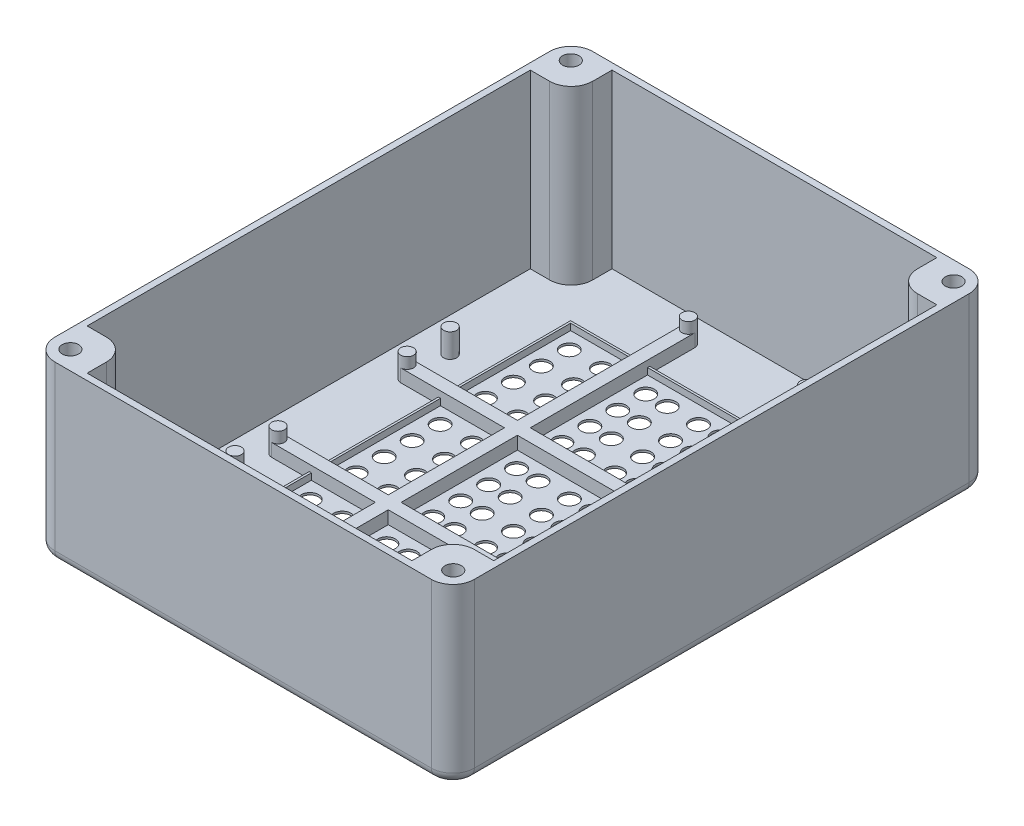
from build123d import *

# Parameters (mm, degrees)
SKETCH1_W              = 195
SKETCH1_H              = 250
SKETCH1_W_2            = 189
SKETCH1_H_2            = 244
BOSS_EXTRUDE1_DEPTH    = 80
SKETCH2_W              = 22
SKETCH2_H              = 22
BOSS_EXTRUDE2_DEPTH    = 80
SKETCH4_R              = 3
BOSS_EXTRUDE3_DEPTH    = 11.1
SKETCH4_R_2            = 4
BOSS_EXTRUDE3_2_DEPTH  = 11.1
BOSS_EXTRUDE3_3_DEPTH  = 11.1
BOSS_EXTRUDE3_4_DEPTH  = 11.1
BOSS_EXTRUDE3_5_DEPTH  = 11.1
BOSS_EXTRUDE3_6_DEPTH  = 11.1
BOSS_EXTRUDE3_7_DEPTH  = 11.1
BOSS_EXTRUDE3_8_DEPTH  = 11.1
BOSS_EXTRUDE3_9_DEPTH  = 11.1
BOSS_EXTRUDE3_10_DEPTH = 11.1
BOSS_EXTRUDE3_11_DEPTH = 11.1
BOSS_EXTRUDE3_12_DEPTH = 11.1
BOSS_EXTRUDE3_13_DEPTH = 11.1
SKETCH5_W              = 195
SKETCH5_H              = 250
BOSS_EXTRUDE4_DEPTH    = 1
FILLET1_R              = 10
FILLET2_R              = 10
FILLET3_R              = 5
SKETCH6_W              = 122.5
SKETCH6_H              = 177
SKETCH6_W_2            = 120.5
SKETCH6_H_2            = 175
BOSS_EXTRUDE5_DEPTH    = 3
SKETCH7_W              = 6
SKETCH7_H              = 219.117056947
SKETCH7_H_2            = 218.65559357
SKETCH7_W_2            = 157.5
SKETCH7_H_3            = 6
BOSS_EXTRUDE6_DEPTH    = 6
SKETCH8_W              = 122.5
SKETCH8_H              = 177
SKETCH8_W_2            = 120.5
SKETCH8_H_2            = 175
BOSS_EXTRUDE7_DEPTH    = 3
CUT_EXTRUDE1_START     = 80
CUT_EXTRUDE1_DEPTH     = 50
SKETCH10_R             = 4
CUT_EXTRUDE2_DEPTH     = 173.853868975
SKETCH11_R             = 4
SKETCH11_R_2           = 3.9375
CUT_EXTRUDE3_DEPTH     = 178.570408626


with BuildPart() as part:
    # Sketch1 → Boss-Extrude1 (new body)
    with BuildSketch(Plane(origin=(0, 0, 0), x_dir=(1, 0, 0), z_dir=(0, 1, 0))):
        Rectangle(SKETCH1_W, SKETCH1_H)
        Rectangle(SKETCH1_W_2, SKETCH1_H_2, mode=Mode.SUBTRACT)
    extrude(amount=BOSS_EXTRUDE1_DEPTH)

    # Sketch2 → Boss-Extrude2 (add)
    with BuildSketch(Plane.XZ):
        with Locations((86.5, -114)):
            Rectangle(SKETCH2_W, SKETCH2_H)
        with Locations((-86.5, -114)):
            Rectangle(SKETCH2_W, SKETCH2_H)
        with Locations((-86.5, 114)):
            Rectangle(SKETCH2_W, SKETCH2_H)
        with Locations((86.5, 114)):
            Rectangle(SKETCH2_W, SKETCH2_H)
    extrude(amount=-BOSS_EXTRUDE2_DEPTH)



with BuildPart() as body_2:
    # Sketch4 → Boss-Extrude3 (new body)
    with BuildSketch(Plane(origin=(0, 0, 0), x_dir=(1, 0, 0), z_dir=(0, 1, 0))):
        with Locations(Location((-27.5, -109.5, 0), (0, 0, 270))):
            Circle(SKETCH4_R)
    extrude(amount=BOSS_EXTRUDE3_DEPTH)


with BuildPart() as body_3:
    # Sketch4 → Boss-Extrude3 2 (new body)
    with BuildSketch(Plane(origin=(0, 0, 0), x_dir=(1, 0, 0), z_dir=(0, 1, 0))):
        with Locations(Location((-60.5, -109.5, 0), (0, 0, 270))):
            Circle(SKETCH4_R_2)
    extrude(amount=BOSS_EXTRUDE3_2_DEPTH)


with BuildPart() as body_4:
    # Sketch4 → Boss-Extrude3 3 (new body)
    with BuildSketch(Plane(origin=(0, 0, 0), x_dir=(1, 0, 0), z_dir=(0, 1, 0))):
        with Locations(Location((27.5, -109.5, 0), (0, 0, 270))):
            Circle(SKETCH4_R)
    extrude(amount=BOSS_EXTRUDE3_3_DEPTH)


with BuildPart() as body_5:
    # Sketch4 → Boss-Extrude3 4 (new body)
    with BuildSketch(Plane(origin=(0, 0, 0), x_dir=(1, 0, 0), z_dir=(0, 1, 0))):
        with Locations(Location((-78.75, -50, 0), (0, 0, 270))):
            Circle(SKETCH4_R)
    extrude(amount=BOSS_EXTRUDE3_4_DEPTH)


with BuildPart() as body_6:
    # Sketch4 → Boss-Extrude3 5 (new body)
    with BuildSketch(Plane(origin=(0, 0, 0), x_dir=(1, 0, 0), z_dir=(0, 1, 0))):
        with Locations(Location((-78.75, -30, 0), (0, 0, 270))):
            Circle(SKETCH4_R)
    extrude(amount=BOSS_EXTRUDE3_5_DEPTH)


with BuildPart() as body_7:
    # Sketch4 → Boss-Extrude3 6 (new body)
    with BuildSketch(Plane(origin=(0, 0, 0), x_dir=(1, 0, 0), z_dir=(0, 1, 0))):
        with Locations(Location((78.75, -50, 0), (0, 0, 270))):
            Circle(SKETCH4_R)
    extrude(amount=BOSS_EXTRUDE3_6_DEPTH)


with BuildPart() as body_8:
    # Sketch4 → Boss-Extrude3 7 (new body)
    with BuildSketch(Plane(origin=(0, 0, 0), x_dir=(1, 0, 0), z_dir=(0, 1, 0))):
        with Locations(Location((78.75, -30, 0), (0, 0, 270))):
            Circle(SKETCH4_R)
    extrude(amount=BOSS_EXTRUDE3_7_DEPTH)


with BuildPart() as body_9:
    # Sketch4 → Boss-Extrude3 8 (new body)
    with BuildSketch(Plane(origin=(0, 0, 0), x_dir=(1, 0, 0), z_dir=(0, 1, 0))):
        with Locations(Location((-78.75, 30, 0), (0, 0, 270))):
            Circle(SKETCH4_R)
    extrude(amount=BOSS_EXTRUDE3_8_DEPTH)


with BuildPart() as body_10:
    # Sketch4 → Boss-Extrude3 9 (new body)
    with BuildSketch(Plane(origin=(0, 0, 0), x_dir=(1, 0, 0), z_dir=(0, 1, 0))):
        with Locations(Location((78.75, 30, 0), (0, 0, 270))):
            Circle(SKETCH4_R)
    extrude(amount=BOSS_EXTRUDE3_9_DEPTH)


with BuildPart() as body_11:
    # Sketch4 → Boss-Extrude3 10 (new body)
    with BuildSketch(Plane(origin=(0, 0, 0), x_dir=(1, 0, 0), z_dir=(0, 1, 0))):
        with Locations(Location((-27.5, 109.5, 0), (0, 0, 270))):
            Circle(SKETCH4_R)
    extrude(amount=BOSS_EXTRUDE3_10_DEPTH)


with BuildPart() as body_12:
    # Sketch4 → Boss-Extrude3 11 (new body)
    with BuildSketch(Plane(origin=(0, 0, 0), x_dir=(1, 0, 0), z_dir=(0, 1, 0))):
        with Locations(Location((-78.75, 50, 0), (0, 0, 270))):
            Circle(SKETCH4_R)
    extrude(amount=BOSS_EXTRUDE3_11_DEPTH)


with BuildPart() as body_13:
    # Sketch4 → Boss-Extrude3 12 (new body)
    with BuildSketch(Plane(origin=(0, 0, 0), x_dir=(1, 0, 0), z_dir=(0, 1, 0))):
        with Locations(Location((27.5, 109.5, 0), (0, 0, 270))):
            Circle(SKETCH4_R)
    extrude(amount=BOSS_EXTRUDE3_12_DEPTH)


with BuildPart() as body_14:
    # Sketch4 → Boss-Extrude3 13 (new body)
    with BuildSketch(Plane(origin=(0, 0, 0), x_dir=(1, 0, 0), z_dir=(0, 1, 0))):
        with Locations(Location((78.75, 50, 0), (0, 0, 270))):
            Circle(SKETCH4_R)
    extrude(amount=BOSS_EXTRUDE3_13_DEPTH)


with BuildPart() as part_1:
    add(part.part)

    add(body_7.part)  # Boss-Extrude4 merges body 7

    add(body_5.part)  # Boss-Extrude4 merges body 5

    add(body_6.part)  # Boss-Extrude4 merges body 6

    add(body_9.part)  # Boss-Extrude4 merges body 9

    add(body_12.part)  # Boss-Extrude4 merges body 12

    add(body_11.part)  # Boss-Extrude4 merges body 11

    add(body_13.part)  # Boss-Extrude4 merges body 13

    add(body_14.part)  # Boss-Extrude4 merges body 14

    add(body_10.part)  # Boss-Extrude4 merges body 10

    add(body_8.part)  # Boss-Extrude4 merges body 8

    add(body_2.part)  # Boss-Extrude4 merges body 2

    add(body_4.part)  # Boss-Extrude4 merges body 4
    # Sketch5 → Boss-Extrude4 (add)
    with BuildSketch(Plane.XZ):
        Rectangle(SKETCH5_W, SKETCH5_H)
    extrude(amount=BOSS_EXTRUDE4_DEPTH)

    # Fillet1
    fillet1_edges = [part_1.edges().sort_by_distance(p)[0] for p in [
        (75.5, 40, 103),
        (75.5, 40, -103),
        (-75.5, 40, -103),
        (-75.5, 40, 103),
    ]]
    fillet(fillet1_edges, radius=FILLET1_R)

    # Fillet2
    fillet2_edges = [part_1.edges().sort_by_distance(p)[0] for p in [
        (97.5, 39.5, 125),
        (-97.5, 39.5, 125),
        (-97.5, 39.5, -125),
        (97.5, 39.5, -125),
    ]]
    fillet(fillet2_edges, radius=FILLET2_R)

    # Fillet3
    fillet3_edges = [part_1.edges().sort_by_distance(p)[0] for p in [
        (0, -1, -125),
        (-97.5, -1, 0),
        (97.5, -1, 0),
        (0, -1, 125),
        (94.571067812, -1, 122.071067812),
        (-94.571067812, -1, 122.071067812),
        (-94.571067812, -1, -122.071067812),
        (94.571067812, -1, -122.071067812),
    ]]
    fillet(fillet3_edges, radius=FILLET3_R)

    # Sketch6 → Boss-Extrude5 (add)
    with BuildSketch(Plane.XZ.offset(1)):
        Rectangle(SKETCH6_W, SKETCH6_H)
        Rectangle(SKETCH6_W_2, SKETCH6_H_2, mode=Mode.SUBTRACT)
    extrude(amount=BOSS_EXTRUDE5_DEPTH)

    # Sketch7 → Boss-Extrude6 (add)
    with BuildSketch(Plane(origin=(0, 0, 0), x_dir=(1, 0, 0), z_dir=(0, 1, 0))):
        with Locations((-27.5, 0.058528474)):
            Rectangle(SKETCH7_W, SKETCH7_H)
        with Locations((27.5, -0.172203215)):
            Rectangle(SKETCH7_W, SKETCH7_H_2)
        with Locations((-0.070692153, -30.025120874)):
            Rectangle(SKETCH7_W_2, SKETCH7_H_3)
        with Locations((0, 30)):
            Rectangle(SKETCH7_W_2, SKETCH7_H_3)
    extrude(amount=BOSS_EXTRUDE6_DEPTH)

    # Sketch8 → Boss-Extrude7 (add)
    with BuildSketch(Plane(origin=(0, 0, 0), x_dir=(1, 0, 0), z_dir=(0, 1, 0))):
        Rectangle(SKETCH8_W, SKETCH8_H)
        Rectangle(SKETCH8_W_2, SKETCH8_H_2, mode=Mode.SUBTRACT)
    extrude(amount=BOSS_EXTRUDE7_DEPTH)

    # Sketch9 → Cut-Extrude1 (cut)
    with BuildSketch(Plane(origin=(0, 0, 0), x_dir=(1, 0, 0), z_dir=(0, 1, 0)).offset(CUT_EXTRUDE1_START)):
        with BuildLine():
            ThreePointArc((92.782041057, 116.290479078), (88.97392359, 120.098596545), (85.165806124, 116.290479078))
            Line((85.165806124, 116.290479078), (88.97392359, 116.290479078))
            Line((88.97392359, 116.290479078), (88.97392359, 112.482361612))
            ThreePointArc((88.97392359, 112.482361612), (91.666669274, 113.597733394), (92.782041057, 116.290479078))
        make_face()
        with BuildLine():
            Line((88.97392359, 116.290479078), (85.165806124, 116.290479078))
            ThreePointArc((85.165806124, 116.290479078), (86.281177906, 113.597733394), (88.97392359, 112.482361612))
            Line((88.97392359, 112.482361612), (88.97392359, 116.290479078))
        make_face()
        with BuildLine():
            ThreePointArc((-88.97392359, 112.482361612), (-86.281177906, 113.597733394), (-85.165806124, 116.290479078))
            Line((-85.165806124, 116.290479078), (-88.97392359, 116.290479078))
            Line((-88.97392359, 116.290479078), (-88.97392359, 112.482361612))
        make_face()
        with BuildLine():
            Line((-88.97392359, 116.290479078), (-85.165806124, 116.290479078))
            ThreePointArc((-85.165806124, 116.290479078), (-91.666669274, 118.983224762), (-88.97392359, 112.482361612))
            Line((-88.97392359, 112.482361612), (-88.97392359, 116.290479078))
        make_face()
        with BuildLine():
            ThreePointArc((-85.165806124, -116.290479078), (-86.281177906, -113.597733394), (-88.97392359, -112.482361612))
            Line((-88.97392359, -112.482361612), (-88.97392359, -116.290479078))
            Line((-88.97392359, -116.290479078), (-85.165806124, -116.290479078))
        make_face()
        with BuildLine():
            Line((-88.97392359, -116.290479078), (-88.97392359, -112.482361612))
            ThreePointArc((-88.97392359, -112.482361612), (-91.666669274, -118.983224762), (-85.165806124, -116.290479078))
            Line((-85.165806124, -116.290479078), (-88.97392359, -116.290479078))
        make_face()
        with BuildLine():
            ThreePointArc((92.782041057, -116.290479078), (91.666669274, -113.597733394), (88.97392359, -112.482361612))
            Line((88.97392359, -112.482361612), (88.97392359, -116.290479078))
            Line((88.97392359, -116.290479078), (85.165806124, -116.290479078))
            ThreePointArc((85.165806124, -116.290479078), (88.97392359, -120.098596545), (92.782041057, -116.290479078))
        make_face()
        with BuildLine():
            Line((88.97392359, -116.290479078), (88.97392359, -112.482361612))
            ThreePointArc((88.97392359, -112.482361612), (86.281177906, -113.597733394), (85.165806124, -116.290479078))
            Line((85.165806124, -116.290479078), (88.97392359, -116.290479078))
        make_face()
    extrude(amount=-CUT_EXTRUDE1_DEPTH, mode=Mode.SUBTRACT)


with BuildPart() as cut_extrude2_tool:
    # Sketch10 → Cut-Extrude2 (new, through all)
    with BuildSketch(Plane(origin=(0, 11.1, 0), x_dir=(1, 0, 0), z_dir=(0, 1, 0))):
        with Locations(Location((-60.5, -109.5, 0), (0, 0, 270))):
            Circle(SKETCH10_R)
    extrude(amount=-CUT_EXTRUDE2_DEPTH)


with BuildPart() as part_2:
    add(part_1.part)

    # Cut-Extrude2: cut by cut_extrude2_tool
    add(cut_extrude2_tool.part, mode=Mode.SUBTRACT)

    # Sketch11 → Cut-Extrude3 (cut, through all)
    with BuildSketch(Plane(origin=(0, 0, 0), x_dir=(1, 0, 0), z_dir=(0, 1, 0))):
        with Locations(Location((52.8125, -80.0625, 0), (0, 0, 270))):
            Circle(SKETCH11_R)
        with Locations(Location((37.8125, -80.0625, 0), (0, 0, 270))):
            Circle(SKETCH11_R)
        with Locations(Location((37.8125, -67.0625, 0), (0, 0, 270))):
            Circle(SKETCH11_R)
        with Locations(Location((37.8125, -54.0625, 0), (0, 0, 270))):
            Circle(SKETCH11_R)
        with Locations(Location((37.8125, -41.0625, 0), (0, 0, 270))):
            Circle(SKETCH11_R)
        with Locations(Location((52.8125, -67.0625, 0), (0, 0, 270))):
            Circle(SKETCH11_R)
        with Locations(Location((52.8125, -54.0625, 0), (0, 0, 270))):
            Circle(SKETCH11_R)
        with Locations(Location((52.8125, -41.0625, 0), (0, 0, 270))):
            Circle(SKETCH11_R)
        with Locations(Location((37.8125, -19.587620874, 0), (0, 0, 270))):
            Circle(SKETCH11_R_2)
        with Locations(Location((52.8125, -19.587620874, 0), (0, 0, 270))):
            Circle(SKETCH11_R_2)
        with Locations(Location((37.8125, -6.587620874, 0), (0, 0, 270))):
            Circle(SKETCH11_R_2)
        with Locations(Location((37.8125, 6.412379126, 0), (0, 0, 270))):
            Circle(SKETCH11_R_2)
        with Locations(Location((37.8125, 19.412379126, 0), (0, 0, 270))):
            Circle(SKETCH11_R_2)
        with Locations(Location((52.8125, -6.587620874, 0), (0, 0, 270))):
            Circle(SKETCH11_R_2)
        with Locations(Location((52.8125, 6.412379126, 0), (0, 0, 270))):
            Circle(SKETCH11_R_2)
        with Locations(Location((52.8125, 19.412379126, 0), (0, 0, 270))):
            Circle(SKETCH11_R_2)
        with Locations(Location((37.8125, 40.4375, 0), (0, 0, 270))):
            Circle(SKETCH11_R_2)
        with Locations(Location((52.8125, 40.4375, 0), (0, 0, 270))):
            Circle(SKETCH11_R_2)
        with Locations(Location((37.8125, 53.4375, 0), (0, 0, 270))):
            Circle(SKETCH11_R_2)
        with Locations(Location((37.8125, 66.4375, 0), (0, 0, 270))):
            Circle(SKETCH11_R_2)
        with Locations(Location((37.8125, 79.4375, 0), (0, 0, 270))):
            Circle(SKETCH11_R_2)
        with Locations(Location((52.8125, 53.4375, 0), (0, 0, 270))):
            Circle(SKETCH11_R_2)
        with Locations(Location((52.8125, 66.4375, 0), (0, 0, 270))):
            Circle(SKETCH11_R_2)
        with Locations(Location((52.8125, 79.4375, 0), (0, 0, 270))):
            Circle(SKETCH11_R_2)
        with Locations(Location((17.2, -80.0625, 0), (0, 0, 270))):
            Circle(SKETCH11_R)
        with Locations(Location((7.2, -80.0625, 0), (0, 0, 270))):
            Circle(SKETCH11_R)
        with Locations(Location((7.2, -67.0625, 0), (0, 0, 270))):
            Circle(SKETCH11_R)
        with Locations(Location((7.2, -54.0625, 0), (0, 0, 270))):
            Circle(SKETCH11_R)
        with Locations(Location((7.2, -41.0625, 0), (0, 0, 270))):
            Circle(SKETCH11_R)
        with Locations(Location((17.2, -67.0625, 0), (0, 0, 270))):
            Circle(SKETCH11_R)
        with Locations(Location((17.2, -54.0625, 0), (0, 0, 270))):
            Circle(SKETCH11_R)
        with Locations(Location((17.2, -41.0625, 0), (0, 0, 270))):
            Circle(SKETCH11_R)
        with Locations(Location((17.2625, -19.587620874, 0), (0, 0, 270))):
            Circle(SKETCH11_R_2)
        with Locations(Location((7.2625, -19.587620874, 0), (0, 0, 270))):
            Circle(SKETCH11_R_2)
        with Locations(Location((7.2625, -6.587620874, 0), (0, 0, 270))):
            Circle(SKETCH11_R_2)
        with Locations(Location((7.2625, 6.412379126, 0), (0, 0, 270))):
            Circle(SKETCH11_R_2)
        with Locations(Location((7.2625, 19.412379126, 0), (0, 0, 270))):
            Circle(SKETCH11_R_2)
        with Locations(Location((17.2625, -6.587620874, 0), (0, 0, 270))):
            Circle(SKETCH11_R_2)
        with Locations(Location((17.2625, 6.412379126, 0), (0, 0, 270))):
            Circle(SKETCH11_R_2)
        with Locations(Location((17.2625, 19.412379126, 0), (0, 0, 270))):
            Circle(SKETCH11_R_2)
        with Locations(Location((17.2625, 40.4375, 0), (0, 0, 270))):
            Circle(SKETCH11_R_2)
        with Locations(Location((7.2625, 40.4375, 0), (0, 0, 270))):
            Circle(SKETCH11_R_2)
        with Locations(Location((7.2625, 53.4375, 0), (0, 0, 270))):
            Circle(SKETCH11_R_2)
        with Locations(Location((7.2625, 66.4375, 0), (0, 0, 270))):
            Circle(SKETCH11_R_2)
        with Locations(Location((7.2625, 79.4375, 0), (0, 0, 270))):
            Circle(SKETCH11_R_2)
        with Locations(Location((17.2625, 53.4375, 0), (0, 0, 270))):
            Circle(SKETCH11_R_2)
        with Locations(Location((17.2625, 66.4375, 0), (0, 0, 270))):
            Circle(SKETCH11_R_2)
        with Locations(Location((17.2625, 79.4375, 0), (0, 0, 270))):
            Circle(SKETCH11_R_2)
        with Locations(Location((-17.2625, 79.4375, 0), (0, 0, 90))):
            Circle(SKETCH11_R_2)
        with Locations(Location((-17.2625, 66.4375, 0), (0, 0, 90))):
            Circle(SKETCH11_R_2)
        with Locations(Location((-17.2625, 53.4375, 0), (0, 0, 90))):
            Circle(SKETCH11_R_2)
        with Locations(Location((-7.2625, 79.4375, 0), (0, 0, 90))):
            Circle(SKETCH11_R_2)
        with Locations(Location((-7.2625, 66.4375, 0), (0, 0, 90))):
            Circle(SKETCH11_R_2)
        with Locations(Location((-7.2625, 53.4375, 0), (0, 0, 90))):
            Circle(SKETCH11_R_2)
        with Locations(Location((-7.2625, 40.4375, 0), (0, 0, 90))):
            Circle(SKETCH11_R_2)
        with Locations(Location((-17.2625, 40.4375, 0), (0, 0, 90))):
            Circle(SKETCH11_R_2)
        with Locations(Location((-17.2625, 19.412379126, 0), (0, 0, 90))):
            Circle(SKETCH11_R_2)
        with Locations(Location((-17.2625, 6.412379126, 0), (0, 0, 90))):
            Circle(SKETCH11_R_2)
        with Locations(Location((-17.2625, -6.587620874, 0), (0, 0, 90))):
            Circle(SKETCH11_R_2)
        with Locations(Location((-7.2625, 19.412379126, 0), (0, 0, 90))):
            Circle(SKETCH11_R_2)
        with Locations(Location((-7.2625, 6.412379126, 0), (0, 0, 90))):
            Circle(SKETCH11_R_2)
        with Locations(Location((-7.2625, -6.587620874, 0), (0, 0, 90))):
            Circle(SKETCH11_R_2)
        with Locations(Location((-7.2625, -19.587620874, 0), (0, 0, 90))):
            Circle(SKETCH11_R_2)
        with Locations(Location((-17.2625, -19.587620874, 0), (0, 0, 90))):
            Circle(SKETCH11_R_2)
        with Locations(Location((-17.2, -41.0625, 0), (0, 0, 90))):
            Circle(SKETCH11_R)
        with Locations(Location((-17.2, -54.0625, 0), (0, 0, 90))):
            Circle(SKETCH11_R)
        with Locations(Location((-17.2, -67.0625, 0), (0, 0, 90))):
            Circle(SKETCH11_R)
        with Locations(Location((-7.2, -41.0625, 0), (0, 0, 90))):
            Circle(SKETCH11_R)
        with Locations(Location((-7.2, -54.0625, 0), (0, 0, 90))):
            Circle(SKETCH11_R)
        with Locations(Location((-7.2, -67.0625, 0), (0, 0, 90))):
            Circle(SKETCH11_R)
        with Locations(Location((-7.2, -80.0625, 0), (0, 0, 90))):
            Circle(SKETCH11_R)
        with Locations(Location((-17.2, -80.0625, 0), (0, 0, 90))):
            Circle(SKETCH11_R)
        with Locations(Location((-52.8125, 79.4375, 0), (0, 0, 90))):
            Circle(SKETCH11_R_2)
        with Locations(Location((-52.8125, 66.4375, 0), (0, 0, 90))):
            Circle(SKETCH11_R_2)
        with Locations(Location((-52.8125, 53.4375, 0), (0, 0, 90))):
            Circle(SKETCH11_R_2)
        with Locations(Location((-37.8125, 79.4375, 0), (0, 0, 90))):
            Circle(SKETCH11_R_2)
        with Locations(Location((-37.8125, 66.4375, 0), (0, 0, 90))):
            Circle(SKETCH11_R_2)
        with Locations(Location((-37.8125, 53.4375, 0), (0, 0, 90))):
            Circle(SKETCH11_R_2)
        with Locations(Location((-52.8125, 40.4375, 0), (0, 0, 90))):
            Circle(SKETCH11_R_2)
        with Locations(Location((-37.8125, 40.4375, 0), (0, 0, 90))):
            Circle(SKETCH11_R_2)
        with Locations(Location((-52.8125, 19.412379126, 0), (0, 0, 90))):
            Circle(SKETCH11_R_2)
        with Locations(Location((-52.8125, 6.412379126, 0), (0, 0, 90))):
            Circle(SKETCH11_R_2)
        with Locations(Location((-52.8125, -6.587620874, 0), (0, 0, 90))):
            Circle(SKETCH11_R_2)
        with Locations(Location((-37.8125, 19.412379126, 0), (0, 0, 90))):
            Circle(SKETCH11_R_2)
        with Locations(Location((-37.8125, 6.412379126, 0), (0, 0, 90))):
            Circle(SKETCH11_R_2)
        with Locations(Location((-37.8125, -6.587620874, 0), (0, 0, 90))):
            Circle(SKETCH11_R_2)
        with Locations(Location((-52.8125, -19.587620874, 0), (0, 0, 90))):
            Circle(SKETCH11_R_2)
        with Locations(Location((-37.8125, -19.587620874, 0), (0, 0, 90))):
            Circle(SKETCH11_R_2)
        with Locations(Location((-52.8125, -41.0625, 0), (0, 0, 90))):
            Circle(SKETCH11_R)
        with Locations(Location((-52.8125, -54.0625, 0), (0, 0, 90))):
            Circle(SKETCH11_R)
        with Locations(Location((-52.8125, -67.0625, 0), (0, 0, 90))):
            Circle(SKETCH11_R)
        with Locations(Location((-37.8125, -41.0625, 0), (0, 0, 90))):
            Circle(SKETCH11_R)
        with Locations(Location((-37.8125, -54.0625, 0), (0, 0, 90))):
            Circle(SKETCH11_R)
        with Locations(Location((-37.8125, -67.0625, 0), (0, 0, 90))):
            Circle(SKETCH11_R)
        with Locations(Location((-37.8125, -80.0625, 0), (0, 0, 90))):
            Circle(SKETCH11_R)
        with Locations(Location((-52.8125, -80.0625, 0), (0, 0, 90))):
            Circle(SKETCH11_R)
    extrude(amount=-CUT_EXTRUDE3_DEPTH, mode=Mode.SUBTRACT)


with BuildPart() as body_3_1:
    add(body_3.part)

    # Cut-Extrude2: cut by cut_extrude2_tool
    add(cut_extrude2_tool.part, mode=Mode.SUBTRACT)


solid = part_2.part
